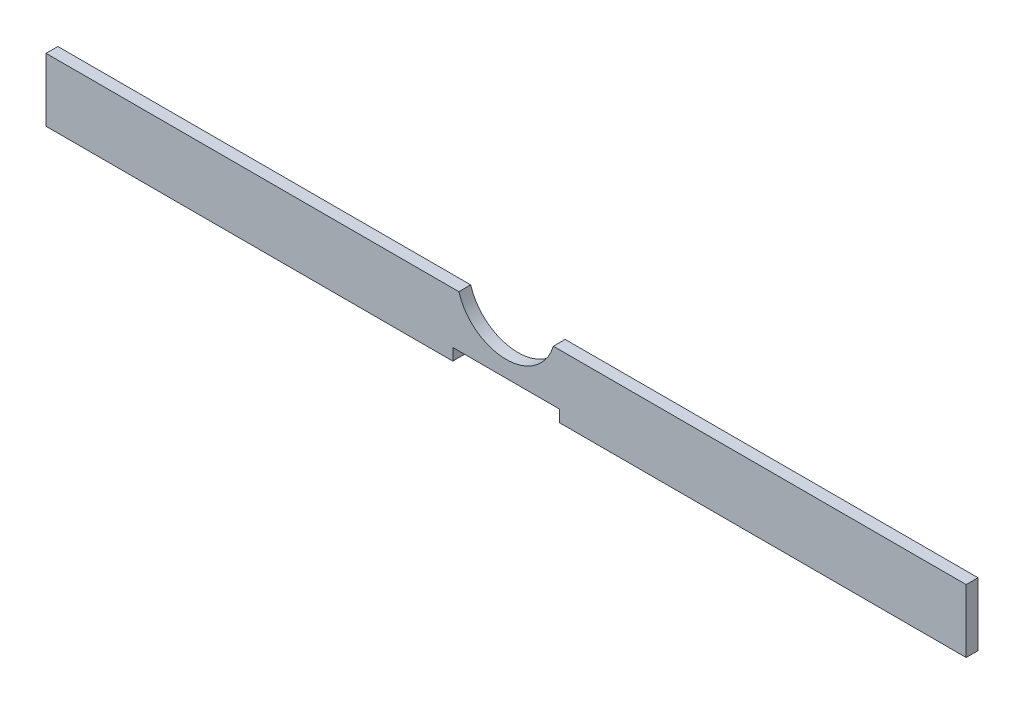
from build123d import *

# Parameters (mm, degrees)
P_IDAT_VYSUNUT_M1_DEPTH = 3


with BuildPart() as part:
    # Skica1 → Přidat vysunutím1 (new body)
    with BuildSketch(Plane.XY):
        with BuildLine():
            Line((-116.5, 0), (-13.5, 0))
            Line((-13.5, 0), (-13.5, 3))
            Line((-13.5, 3), (13.5, 3))
            Line((13.5, 3), (13.5, 0))
            Line((13.5, 0), (116.5, 0))
            Line((116.5, 0), (116.5, 16))
            Line((116.5, 16), (53.5, 16))
            Line((53.5, 16), (11.961316817, 16))
            ThreePointArc((11.961316817, 16), (0, 7.13), (-11.961316817, 16))
            Line((-11.961316817, 16), (-53.5, 16))
            Line((-53.5, 16), (-116.5, 16))
            Line((-116.5, 16), (-116.5, 0))
        make_face()
    extrude(amount=P_IDAT_VYSUNUT_M1_DEPTH)


solid = part.part
